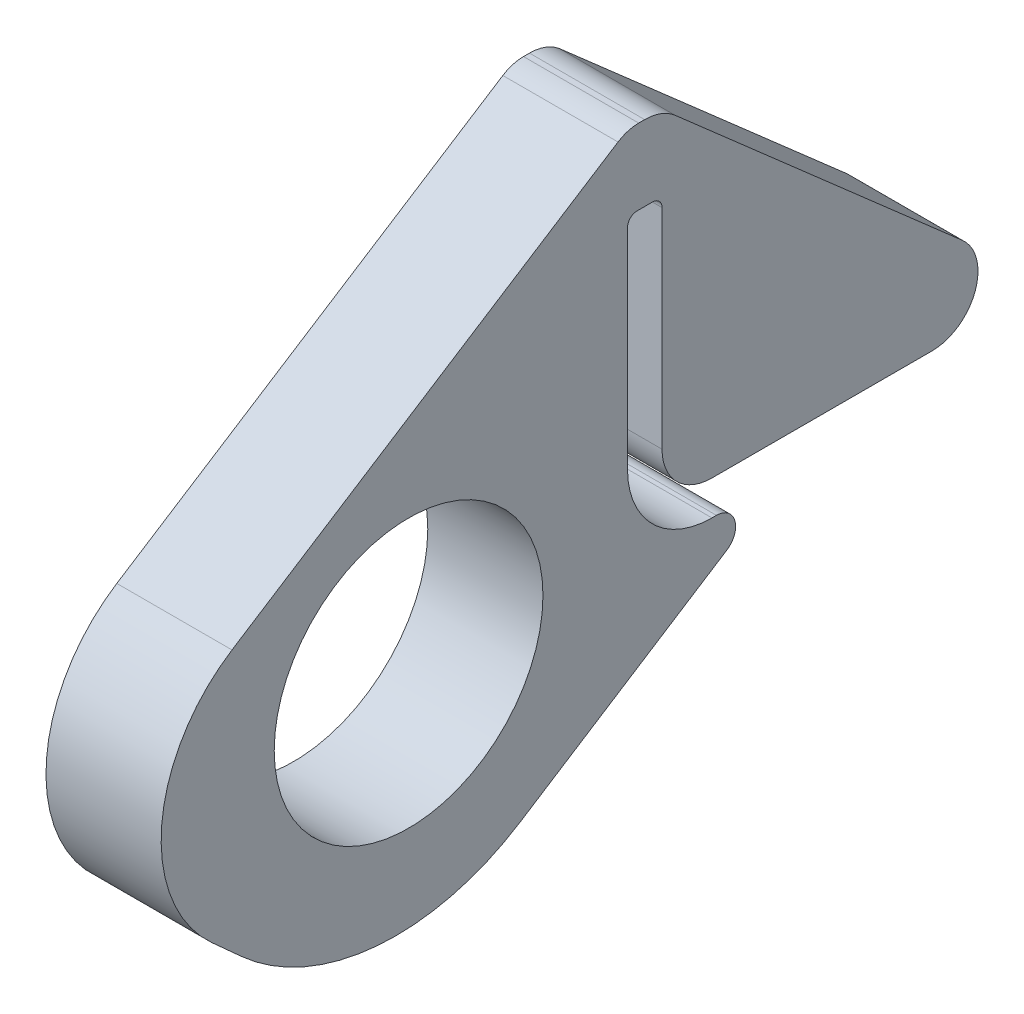
from build123d import *

# Parameters (mm, degrees)
SKETCH3_R           = 3.5
BOSS_EXTRUDE1_DEPTH = 3


with BuildPart() as part:
    # Sketch3 → Boss-Extrude1 (new body)
    with BuildSketch(Plane(origin=(0, 0, 0), x_dir=(0, 0, -1), z_dir=(1, 0, 0))):
        with BuildLine():
            Line((7.72981652, 0.7), (2, 0.7))
            ThreePointArc((2, 0.7), (1.080761184, 1.080761184), (0.7, 2))
            Line((0.7, 2), (0.7, 7.45))
            ThreePointArc((0.7, 7.45), (0.626776695, 7.626776695), (0.45, 7.7))
            Line((0.45, 7.7), (0.05, 7.7))
            ThreePointArc((0.05, 7.7), (-0.126776695, 7.626776695), (-0.2, 7.45))
            Line((-0.2, 7.45), (-0.2, 2))
            ThreePointArc((-0.2, 2), (0.444365081, 0.444365081), (2, -0.2))
            Line((2, -0.2), (2.117066245, -0.2))
            ThreePointArc((2.117066245, -0.2), (2.596969784, -0.559669701), (2.386446273, -1.121229629))
            Line((2.386446273, -1.121229629), (-3.000244885, -4.56606569))
            ThreePointArc((-3.000244885, -4.56606569), (-6.730707864, -5.490615532), (-10.256876598, -3.96179883))
            Line((-10.256876598, -3.96179883), (-11.028611154, -3.264006935))
            ThreePointArc((-11.028611154, -3.264006935), (-12.332100499, 0.034920618), (-10.50093713, 3.072822557))
            Line((-10.50093713, 3.072822557), (-0.446346504, 9.502821112))
            ThreePointArc((-0.446346504, 9.502821112), (-0.188247045, 9.620168933), (0.092413552, 9.660361854))
            Line((0.092413552, 9.660361854), (0.248386958, 9.660361854))
            ThreePointArc((0.248386958, 9.660361854), (0.671058342, 9.583459758), (1.039555867, 9.362610022))
            Line((1.039555867, 9.362610022), (8.520985429, 2.802248168))
            ThreePointArc((8.520985429, 2.802248168), (8.852914424, 1.477328616), (7.72981652, 0.7))
        make_face()
        with Locations((-5.901143056, 0.25)):
            Circle(SKETCH3_R, mode=Mode.SUBTRACT)
    extrude(amount=BOSS_EXTRUDE1_DEPTH)


solid = part.part
